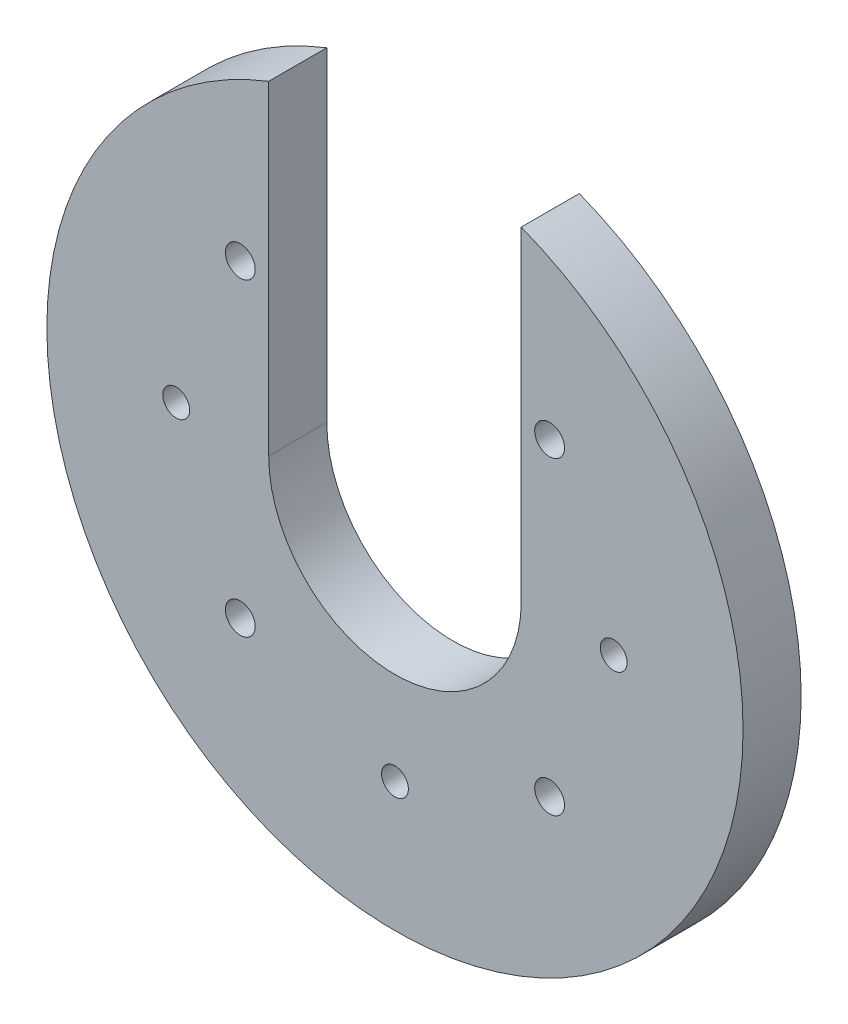
from build123d import *

# Parameters (mm, degrees)
SKETCH1_R           = 1.35
BOSS_EXTRUDE1_DEPTH = 5.842
SKETCH2_R           = 1.5
CUT_EXTRUDE1_DEPTH  = 50.860559066


with BuildPart() as part:
    # Sketch1 → Boss-Extrude1 (new body)
    with BuildSketch(Plane.XY):
        with BuildLine():
            Line((-12.7, 0), (-12.7, 32.629483496))
            ThreePointArc((-12.7, 32.629483496), (0, -35.0139), (12.7, 32.629483496))
            Line((12.7, 32.629483496), (12.7, 0))
            ThreePointArc((12.7, 0), (0, -12.7), (-12.7, 0))
        make_face()
        with Locations((22, 0)):
            Circle(SKETCH1_R, mode=Mode.SUBTRACT)
        with Locations((0, -22)):
            Circle(SKETCH1_R, mode=Mode.SUBTRACT)
        with Locations((-22, 0)):
            Circle(SKETCH1_R, mode=Mode.SUBTRACT)
    extrude(amount=BOSS_EXTRUDE1_DEPTH)

    # Sketch2 → Cut-Extrude1 (cut, through all)
    with BuildSketch(Plane.XY.offset(5.842)):
        with Locations((-15.556349186, -15.556349186)):
            Circle(SKETCH2_R)
        with Locations((-15.556349186, 15.556349186)):
            Circle(SKETCH2_R)
        with Locations((15.556349186, 15.556349186)):
            Circle(SKETCH2_R)
        with Locations((15.556349186, -15.556349186)):
            Circle(SKETCH2_R)
    extrude(amount=-CUT_EXTRUDE1_DEPTH, mode=Mode.SUBTRACT)


solid = part.part
